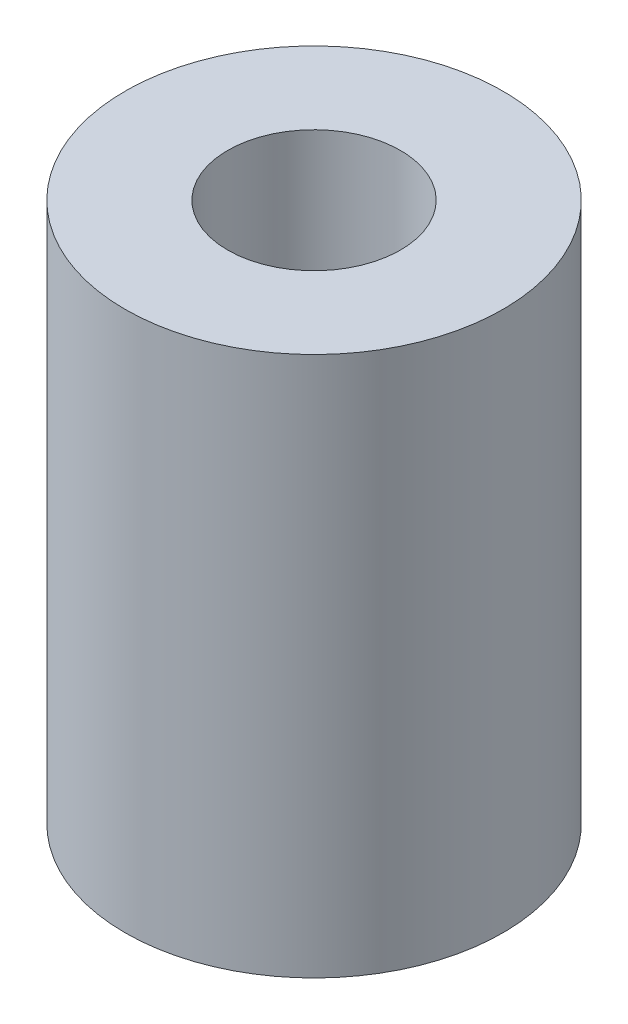
from build123d import *

# Parameters (mm, degrees)
SKETCH1_R           = 3.5
SKETCH1_R_2         = 1.6
BOSS_EXTRUDE1_DEPTH = 5


with BuildPart() as part:
    # Sketch1 → Boss-Extrude1 (new, symmetric)
    with BuildSketch(Plane(origin=(0, 0, 0), x_dir=(1, 0, 0), z_dir=(0, 1, 0))):
        with Locations(Location((0, 0, 0), (0, 0, 270))):
            Circle(SKETCH1_R)
        with Locations(Location((0, 0, 0), (0, 0, 270))):
            Circle(SKETCH1_R_2, mode=Mode.SUBTRACT)
    extrude(amount=BOSS_EXTRUDE1_DEPTH, both=True)


solid = part.part
